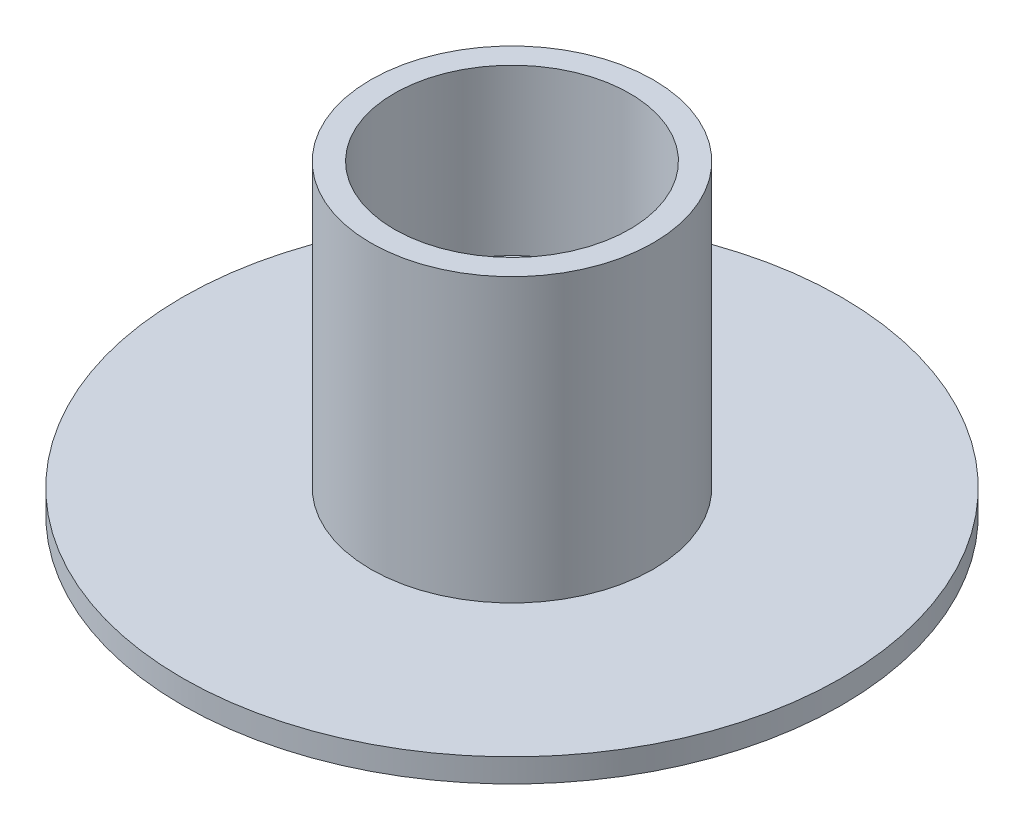
from build123d import *

# Parameters (mm, degrees)
CROQUIS1_R              = 70
SALIENTE_EXTRUIR1_DEPTH = 5
CROQUIS2_R              = 30
SALIENTE_EXTRUIR2_DEPTH = 60
CROQUIS5_R              = 5.25
CORTAR_EXTRUIR5_DEPTH   = 10
CROQUIS7_R              = 25
CORTAR_EXTRUIR6_DEPTH   = 35


with BuildPart() as part:
    # Croquis1 → Saliente-Extruir1 (new body)
    with BuildSketch(Plane(origin=(0, 0, 0), x_dir=(1, 0, 0), z_dir=(0, 1, 0))):
        with Locations(Location((0, 0, 0), (0, 0, 270))):
            Circle(CROQUIS1_R)
    extrude(amount=SALIENTE_EXTRUIR1_DEPTH)

    # Croquis2 → Saliente-Extruir2 (add)
    with BuildSketch(Plane(origin=(0, 5, 0), x_dir=(1, 0, 0), z_dir=(0, 1, 0))):
        with Locations(Location((0, 0, 0), (0, 0, 270))):
            Circle(CROQUIS2_R)
    extrude(amount=SALIENTE_EXTRUIR2_DEPTH)

    # Croquis5 → Cortar-Extruir5 (cut)
    with BuildSketch(Plane.XZ):
        with Locations(Location((0, 0, 0), (0, 0, 270))):
            Circle(CROQUIS5_R)
    extrude(amount=-CORTAR_EXTRUIR5_DEPTH, mode=Mode.SUBTRACT)

    # Croquis7 → Cortar-Extruir6 (cut)
    with BuildSketch(Plane(origin=(0, 65, 0), x_dir=(1, 0, 0), z_dir=(0, 1, 0))):
        with Locations(Location((0, 0, 0), (0, 0, 270))):
            Circle(CROQUIS7_R)
    extrude(amount=-CORTAR_EXTRUIR6_DEPTH, mode=Mode.SUBTRACT)


solid = part.part
